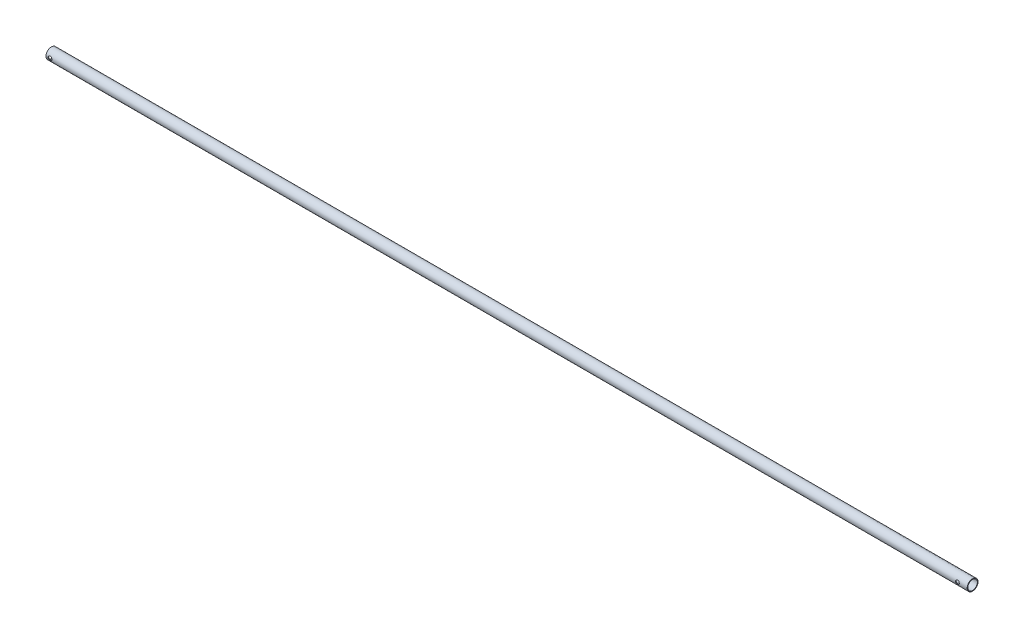
from build123d import *

# Parameters (mm, degrees)
SKETCH1_R               = 8.9662
SKETCH1_R_2             = 7.8994
BOSS_EXTRUDE1_DEPTH     = 1524
CUT_EXTRUDE1_DEPTH      = 1525.05275023
CUT_EXTRUDE1_DEPTH_BACK = 1525.05275023
SKETCH2_R               = 3.175


with BuildPart() as part:
    # Sketch1 → Boss-Extrude1 (new body)
    with BuildSketch(Plane(origin=(0, 0, 0), x_dir=(0, 0, -1), z_dir=(1, 0, 0))):
        Circle(SKETCH1_R)
        Circle(SKETCH1_R_2, mode=Mode.SUBTRACT)
    extrude(amount=BOSS_EXTRUDE1_DEPTH)

    # Sketch2 → Cut-Extrude1 (cut, two sides: drawn at the far end of the back side and taken through both)
    with BuildSketch(Plane.XY.offset(-CUT_EXTRUDE1_DEPTH_BACK)):
        with Locations((1507.796674242, 0)):
            Circle(SKETCH2_R)
        with Locations((6.510807218, 0)):
            Circle(SKETCH2_R)
    extrude(amount=CUT_EXTRUDE1_DEPTH + CUT_EXTRUDE1_DEPTH_BACK, mode=Mode.SUBTRACT)


solid = part.part
